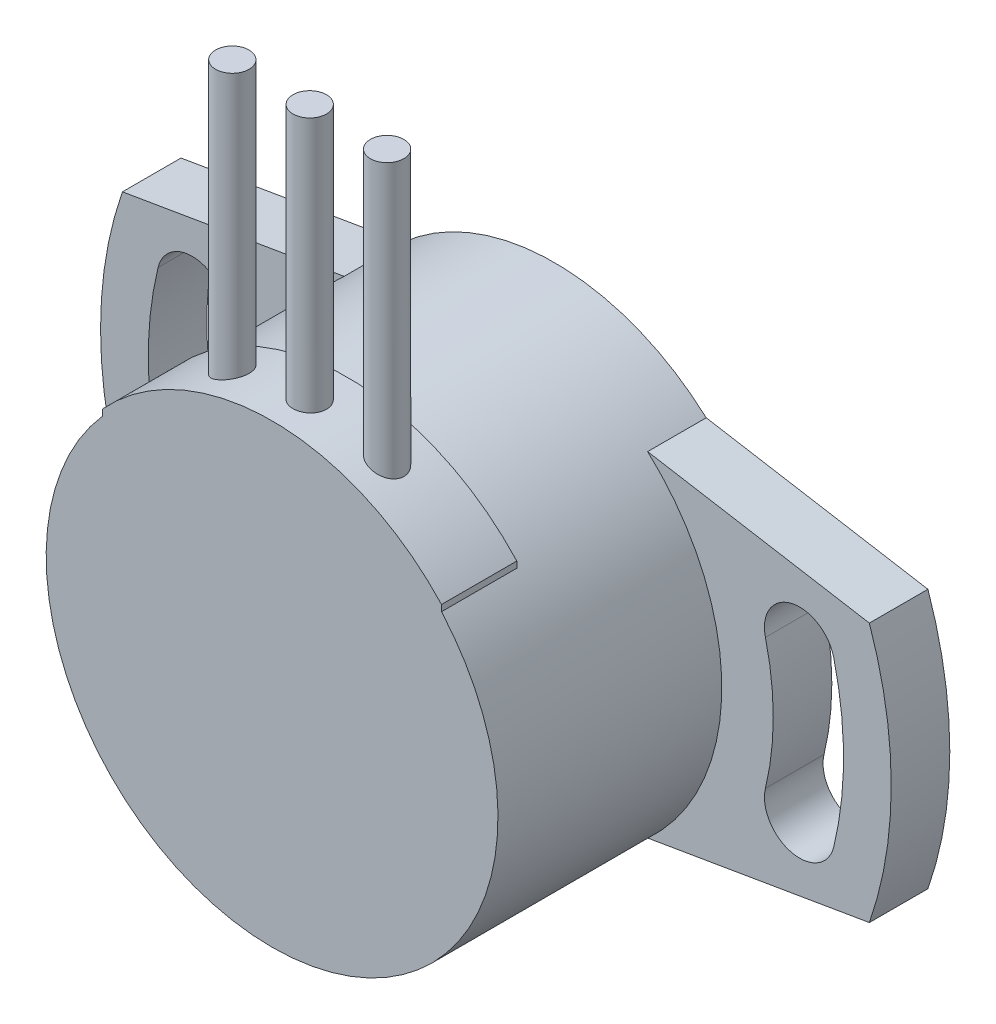
from build123d import *
from build123d.topology import SkipClean

# Parameters (mm, degrees)
SKETCH1_R           = 13.716
BOSS_EXTRUDE1_DEPTH = 13.589
BOSS_EXTRUDE2_START = 3.556
BOSS_EXTRUDE2_DEPTH = 3.556
CUT_EXTRUDE1_DEPTH  = 3.556
SKETCH4_R           = 4.953
BOSS_EXTRUDE3_DEPTH = 4.826
SKETCH5_R           = 3.01625
CUT_EXTRUDE2_DEPTH  = 2.54
BOSS_EXTRUDE4_START = -4.572
BOSS_EXTRUDE4_DEPTH = 4.572
SKETCH6_R           = 1.016
BOSS_EXTRUDE5_DEPTH = 29.464


with BuildPart() as part:
    # Sketch1 → Boss-Extrude1 (new body)
    with BuildSketch(Plane.XY):
        Circle(SKETCH1_R)
    extrude(amount=BOSS_EXTRUDE1_DEPTH)

    # Sketch2 → Boss-Extrude2 (add)
    with BuildSketch(Plane(origin=(0, 0, 0), x_dir=(-1, 0, 0), z_dir=(0, 0, -1)).offset(BOSS_EXTRUDE2_START)):
        with BuildLine():
            Line((-9.214285431, 10.16), (-22.674746592, 7.874))
            ThreePointArc((-22.674746592, 7.874), (-24.003, 0), (-22.674746592, -7.874))
            Line((-22.674746592, -7.874), (-9.214285431, -10.16))
            ThreePointArc((-9.214285431, -10.16), (13.716, 0), (-9.214285431, 10.16))
        make_face()
    boss_extrude2 = extrude(amount=-BOSS_EXTRUDE2_DEPTH)

    # Sketch3 → Cut-Extrude1 (cut)
    with BuildSketch(Plane(origin=(0, 0, -3.556), x_dir=(-1, 0, 0), z_dir=(0, 0, -1))):
        with BuildLine():
            ThreePointArc((-16.365965281, -3.96831406), (-16.8402, 6.1e-08), (-16.365965252, 3.968314178))
            ThreePointArc((-16.365965252, 3.968314178), (-17.93670842, 6.544602887), (-20.512997182, 4.973859806))
            ThreePointArc((-20.512997182, 4.973859806), (-21.1074, 4.2e-08), (-20.512997202, -4.973859724))
            ThreePointArc((-20.512997202, -4.973859724), (-17.936708402, -6.544602882), (-16.365965281, -3.96831406))
        make_face()
    cut_extrude1 = extrude(amount=-CUT_EXTRUDE1_DEPTH, mode=Mode.SUBTRACT)

    # Mirror1: Boss-Extrude2, Cut-Extrude1 across plane
    add(boss_extrude2.mirror(Plane(origin=(0, 0, 0), x_dir=(0, 0, 1), z_dir=(1, 0, 0))))
    add(cut_extrude1.mirror(Plane(origin=(0, 0, 0), x_dir=(0, 0, 1), z_dir=(1, 0, 0))), mode=Mode.SUBTRACT)

    # Sketch4 → Boss-Extrude3 (add)
    with BuildSketch(Plane(origin=(0, 0, -3.556), x_dir=(-1, 0, 0), z_dir=(0, 0, -1))):
        Circle(SKETCH4_R)
    extrude(amount=BOSS_EXTRUDE3_DEPTH)

    # Sketch5 → Cut-Extrude2 (cut)
    with BuildSketch(Plane(origin=(0, 0, -8.382), x_dir=(-1, 0, 0), z_dir=(0, 0, -1))):
        Circle(SKETCH5_R)
    extrude(amount=-CUT_EXTRUDE2_DEPTH, mode=Mode.SUBTRACT)

    # Sketch7 → Boss-Extrude4 (add)
    with BuildSketch(Plane.XY.offset(13.589).offset(BOSS_EXTRUDE4_START)):
        with BuildLine():
            Line((0, 5.951559827), (0, 13.716))
            ThreePointArc((0, 13.716), (-5.643281246, 12.501281246), (-10.287, 9.072281246))
            Line((-10.287, 9.072281246), (-10.287, 5.951559827))
            Line((-10.287, 5.951559827), (0, 5.951559827))
        make_face()
        with BuildLine():
            Line((10.287, 5.951559827), (10.287, 9.072281246))
            ThreePointArc((10.287, 9.072281246), (5.643281246, 12.501281246), (0, 13.716))
            Line((0, 13.716), (0, 5.951559827))
            Line((0, 5.951559827), (10.287, 5.951559827))
        make_face()
        with BuildLine():
            Line((0, 13.716), (0, 13.97))
            ThreePointArc((0, 13.97), (-5.617729535, 12.790700328), (-10.287, 9.45190621))
            Line((-10.287, 9.45190621), (-10.287, 9.072281246))
            ThreePointArc((-10.287, 9.072281246), (-5.643281246, 12.501281246), (0, 13.716))
        make_face()
        with BuildLine():
            Line((10.287, 9.072281246), (10.287, 9.45190621))
            ThreePointArc((10.287, 9.45190621), (5.617729535, 12.790700328), (0, 13.97))
            Line((0, 13.97), (0, 13.716))
            ThreePointArc((0, 13.716), (5.643281246, 12.501281246), (10.287, 9.072281246))
        make_face()
    extrude(amount=BOSS_EXTRUDE4_DEPTH)

    # Sketch6 → Boss-Extrude5 (add)
    with SkipClean():  # the faces are left unmerged after this step: merging them gives an invalid solid
        with BuildSketch(Plane(origin=(0, 0, 0), x_dir=(1, 0, 0), z_dir=(0, 1, 0))):
            with Locations(Location((0, -11.303, 0), (0, 0, 90))):
                Circle(SKETCH6_R)
            with Locations(Location((-4.699, -11.303, 0), (0, 0, 90))):
                Circle(SKETCH6_R)
            with Locations(Location((4.699, -11.303, 0), (0, 0, 90))):
                Circle(SKETCH6_R)
        extrude(amount=BOSS_EXTRUDE5_DEPTH)


solid = part.part
